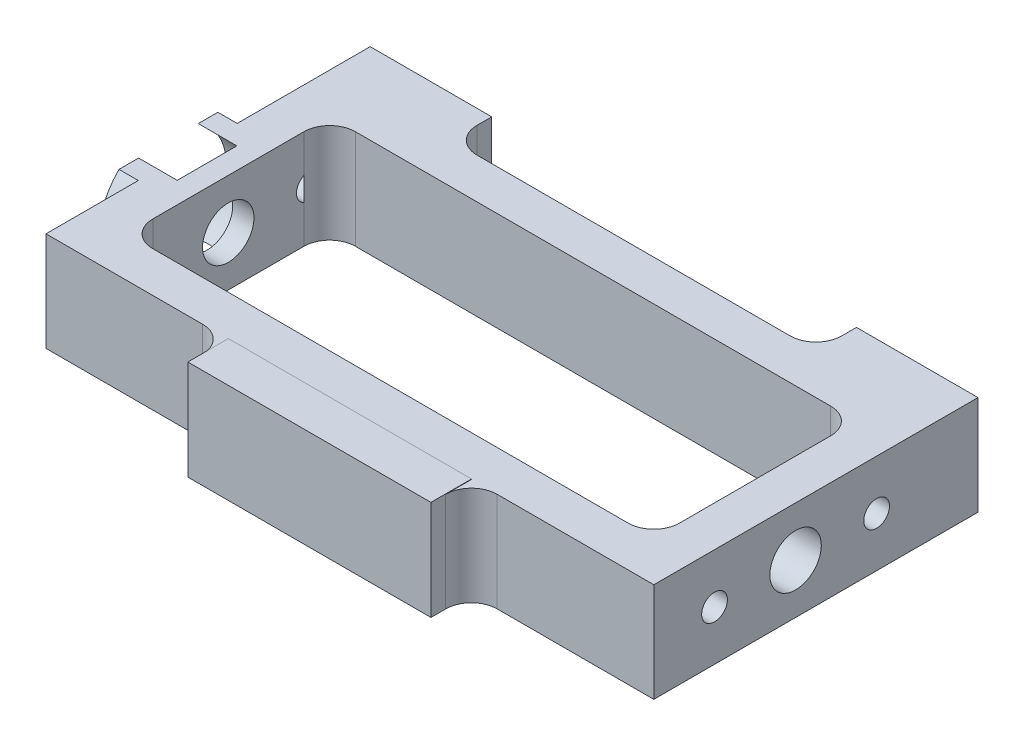
from build123d import *

# Parameters (mm, degrees)
CROQUIS1_W              = 150
CROQUIS1_H              = 90
SALIENTE_EXTRUIR1_DEPTH = 24.5
CORTAR_EXTRUIR2_DEPTH   = 91.830886817
CROQUIS6_R              = 14.2875
CORTAR_EXTRUIR3_DEPTH   = 4.7625
CORTAR_EXTRUIR4_START   = -140
CROQUIS2_R              = 6.35
CROQUIS2_R_2            = 3.175
CORTAR_EXTRUIR4_DEPTH   = 5.2375
CORTAR_EXTRUIR1_DEPTH   = 41
SALIENTE_EXTRUIR2_START = 4.7625
SALIENTE_EXTRUIR2_DEPTH = 4.7625
CROQUIS8_W              = 60
CROQUIS8_H              = 10
SALIENTE_EXTRUIR3_DEPTH = 0.1


with BuildPart() as part:
    # Croquis1 → Saliente-Extruir1 (new body)
    with BuildSketch(Plane(origin=(0, 0, 0), x_dir=(1, 0, 0), z_dir=(0, 1, 0))):
        Rectangle(CROQUIS1_W, CROQUIS1_H)
    extrude(amount=SALIENTE_EXTRUIR1_DEPTH)

    # Croquis3 → Cortar-Extruir2 (cut, through all)
    with BuildSketch(Plane(origin=(0, 24.5, 0), x_dir=(1, 0, 0), z_dir=(0, 1, 0))):
        with BuildLine():
            Line((58.65, -25), (-58.65, -25))
            ThreePointArc((-58.65, -25), (-63.140128061, -23.140128061), (-65, -18.65))
            Line((-65, -18.65), (-65, 18.65))
            ThreePointArc((-65, 18.65), (-63.140128061, 23.140128061), (-58.65, 25))
            Line((-58.65, 25), (58.65, 25))
            ThreePointArc((58.65, 25), (63.140128061, 23.140128061), (65, 18.65))
            Line((65, 18.65), (65, -18.65))
            ThreePointArc((65, -18.65), (63.140128061, -23.140128061), (58.65, -25))
        make_face()
        with BuildLine():
            Line((-75, -45), (-30, -45))
            Line((-30, -45), (-30, -41.35))
            ThreePointArc((-30, -41.35), (-31.859871939, -36.859871939), (-36.35, -35))
            Line((-36.35, -35), (-75, -35))
            Line((-75, -35), (-75, -45))
        make_face()
        with BuildLine():
            Line((75, -45), (30, -45))
            Line((30, -45), (30, -41.35))
            ThreePointArc((30, -41.35), (31.859871939, -36.859871939), (36.35, -35))
            Line((36.35, -35), (75, -35))
            Line((75, -35), (75, -45))
        make_face()
        with BuildLine():
            Line((-45, 45), (45, 45))
            Line((45, 45), (45, 41.35))
            ThreePointArc((45, 41.35), (43.140128061, 36.859871939), (38.65, 35))
            Line((38.65, 35), (-38.65, 35))
            ThreePointArc((-38.65, 35), (-43.140128061, 36.859871939), (-45, 41.35))
            Line((-45, 41.35), (-45, 45))
        make_face()
    extrude(amount=-CORTAR_EXTRUIR2_DEPTH, mode=Mode.SUBTRACT)

    # Croquis6 → Cortar-Extruir3 (cut)
    with BuildSketch(Plane.ZY.offset(75)):
        with Locations((0.019345319, 12.255943197)):
            Circle(CROQUIS6_R)
    extrude(amount=-CORTAR_EXTRUIR3_DEPTH, mode=Mode.SUBTRACT)

    # Croquis2 → Cortar-Extruir4 (cut)
    with BuildSketch(Plane(origin=(75, 0, 0), x_dir=(0, 0, -1), z_dir=(1, 0, 0)).offset(CORTAR_EXTRUIR4_START)):
        with Locations(Location((-0.019345319, 12.255943197, 0), (0, 0, 180))):
            Circle(CROQUIS2_R)
        with Locations(Location((-20.019346202, 12.25, 0), (0, 0, 64.450536277))):
            Circle(CROQUIS2_R_2)
        with Locations(Location((19.980653798, 12.25, 0), (0, 0, 114.778004308))):
            Circle(CROQUIS2_R_2)
    extrude(amount=-CORTAR_EXTRUIR4_DEPTH, mode=Mode.SUBTRACT)

    # Croquis2 → Cortar-Extruir1 (cut)
    with BuildSketch(Plane(origin=(75, 0, 0), x_dir=(0, 0, -1), z_dir=(1, 0, 0))):
        with Locations(Location((-0.019345319, 12.255943197, 0), (0, 0, 180))):
            Circle(CROQUIS2_R)
        with Locations(Location((-20.019346202, 12.25, 0), (0, 0, 64.450536277))):
            Circle(CROQUIS2_R_2)
        with Locations(Location((19.980653798, 12.25, 0), (0, 0, 114.778004308))):
            Circle(CROQUIS2_R_2)
    extrude(amount=-CORTAR_EXTRUIR1_DEPTH, mode=Mode.SUBTRACT)

    # Croquis7 → Saliente-Extruir2 (add)
    with BuildSketch(Plane.ZY.offset(75).offset(SALIENTE_EXTRUIR2_START)):
        with BuildLine():
            Line((-12.18478223, 24.5), (-7.343787794, 24.5))
            ThreePointArc((-7.343787794, 24.5), (-14.268150014, 12.244395432), (-7.323985846, 0))
            Line((-7.323985846, 0), (-12.172845321, 0))
            ThreePointArc((-12.172845321, 0), (-17.268152629, 12.247520368), (-12.18478223, 24.5))
        make_face()
        with BuildLine():
            Line((7.382478433, 24.5), (12.223472869, 24.5))
            ThreePointArc((12.223472869, 24.5), (17.306843268, 12.247520368), (12.21153596, 0))
            Line((12.21153596, 0), (7.362676485, 0))
            ThreePointArc((7.362676485, 0), (14.306840653, 12.244395432), (7.382478433, 24.5))
        make_face()
    extrude(amount=-SALIENTE_EXTRUIR2_DEPTH)

    # Croquis8 → Saliente-Extruir3 (add)
    with BuildSketch(Plane(origin=(0, 24.5, 0), x_dir=(1, 0, 0), z_dir=(0, 1, 0))):
        with Locations((0, -40)):
            Rectangle(CROQUIS8_W, CROQUIS8_H)
    extrude(amount=SALIENTE_EXTRUIR3_DEPTH)


solid = part.part
